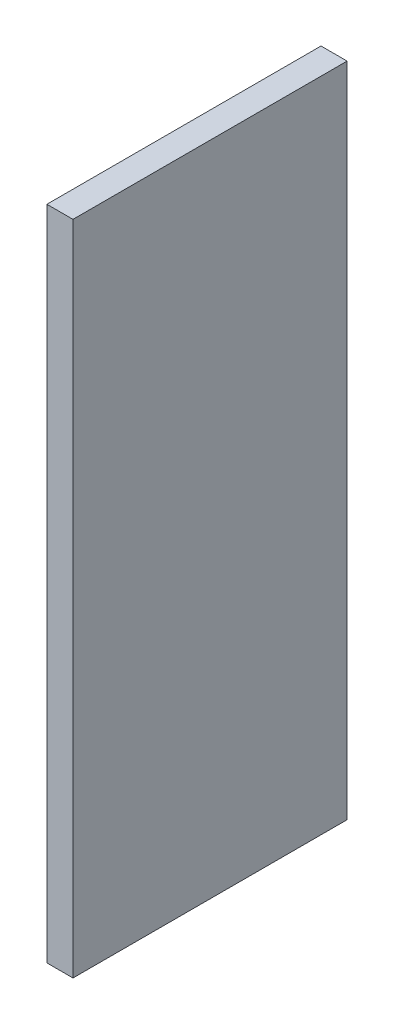
from build123d import *

# Parameters (mm, degrees)
SKETCH_1_W                      = 3
SKETCH_1_H                      = 74
EXTRUDE_1_DEPTH                 = 31.5
SKETCH_2_W                      = 3
SKETCH_2_H                      = 1.5
SIDE_REAR_EXTENSION_1P5MM_DEPTH = 31.5


with BuildPart() as part:
    # Эскиз1 → Бобышка-Вытянуть1 (new body)
    with BuildSketch(Plane.XY):
        with Locations((1.5, 37)):
            Rectangle(SKETCH_1_W, SKETCH_1_H)
    extrude(amount=EXTRUDE_1_DEPTH)

    # Эскиз2 → side_rear_extension_1p5mm (add)
    with BuildSketch(Plane.XY):
        with Locations((1.5, 74.75)):
            Rectangle(SKETCH_2_W, SKETCH_2_H)
    extrude(amount=SIDE_REAR_EXTENSION_1P5MM_DEPTH)


solid = part.part
